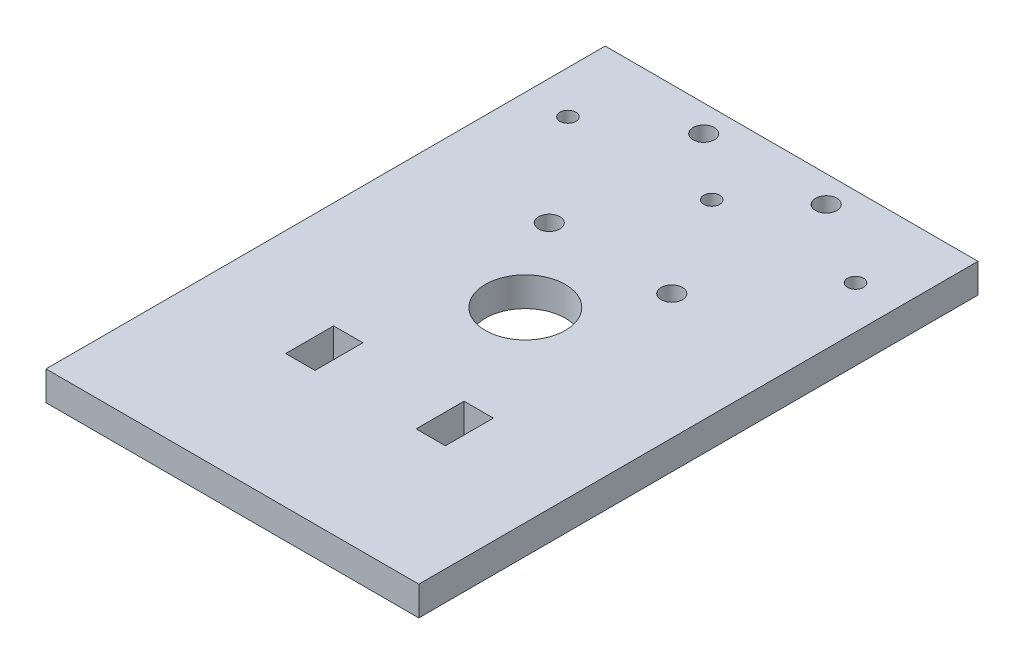
from build123d import *

# Parameters (mm, degrees)
CROQUIS1_W              = 70
CROQUIS1_H              = 105
CROQUIS1_R              = 2
CROQUIS1_R_2            = 7.5
CROQUIS1_R_3            = 1.5
CROQUIS1_W_2            = 5.5
CROQUIS1_H_2            = 9
SALIENTE_EXTRUIR1_DEPTH = 5.5


with BuildPart() as part:
    # Croquis1 → Saliente-Extruir1 (new body)
    with BuildSketch(Plane(origin=(0, 0, 0), x_dir=(1, 0, 0), z_dir=(0, 1, 0))):
        with Locations((-71.406504065, -46.422764228)):
            Rectangle(CROQUIS1_W, CROQUIS1_H)
        with Locations(Location((-82.906504065, 1.077235772, 0), (0, 0, 270))):
            Circle(CROQUIS1_R, mode=Mode.SUBTRACT)
        with Locations(Location((-82.906504065, -27.922764228, 0), (0, 0, 270))):
            Circle(CROQUIS1_R, mode=Mode.SUBTRACT)
        with Locations(Location((-71.406504065, -43.922764228, 0), (0, 0, 270))):
            Circle(CROQUIS1_R_2, mode=Mode.SUBTRACT)
        with Locations(Location((-71.406504065, -8.922764228, 0), (0, 0, 270))):
            Circle(CROQUIS1_R_3, mode=Mode.SUBTRACT)
        with Locations(Location((-59.906504065, -27.922764228, 0), (0, 0, 90))):
            Circle(CROQUIS1_R, mode=Mode.SUBTRACT)
        with Locations(Location((-59.906504065, 1.077235772, 0), (0, 0, 90))):
            Circle(CROQUIS1_R, mode=Mode.SUBTRACT)
        with Locations(Location((-98.406504065, -8.922764228, 0), (0, 0, 270))):
            Circle(CROQUIS1_R_3, mode=Mode.SUBTRACT)
        with Locations(Location((-44.406504065, -8.922764228, 0), (0, 0, 90))):
            Circle(CROQUIS1_R_3, mode=Mode.SUBTRACT)
        with Locations((-83.656504065, -69.422764228)):
            Rectangle(CROQUIS1_W_2, CROQUIS1_H_2, mode=Mode.SUBTRACT)
        with Locations((-59.156504065, -69.422764228)):
            Rectangle(CROQUIS1_W_2, CROQUIS1_H_2, mode=Mode.SUBTRACT)
    extrude(amount=SALIENTE_EXTRUIR1_DEPTH)


solid = part.part
